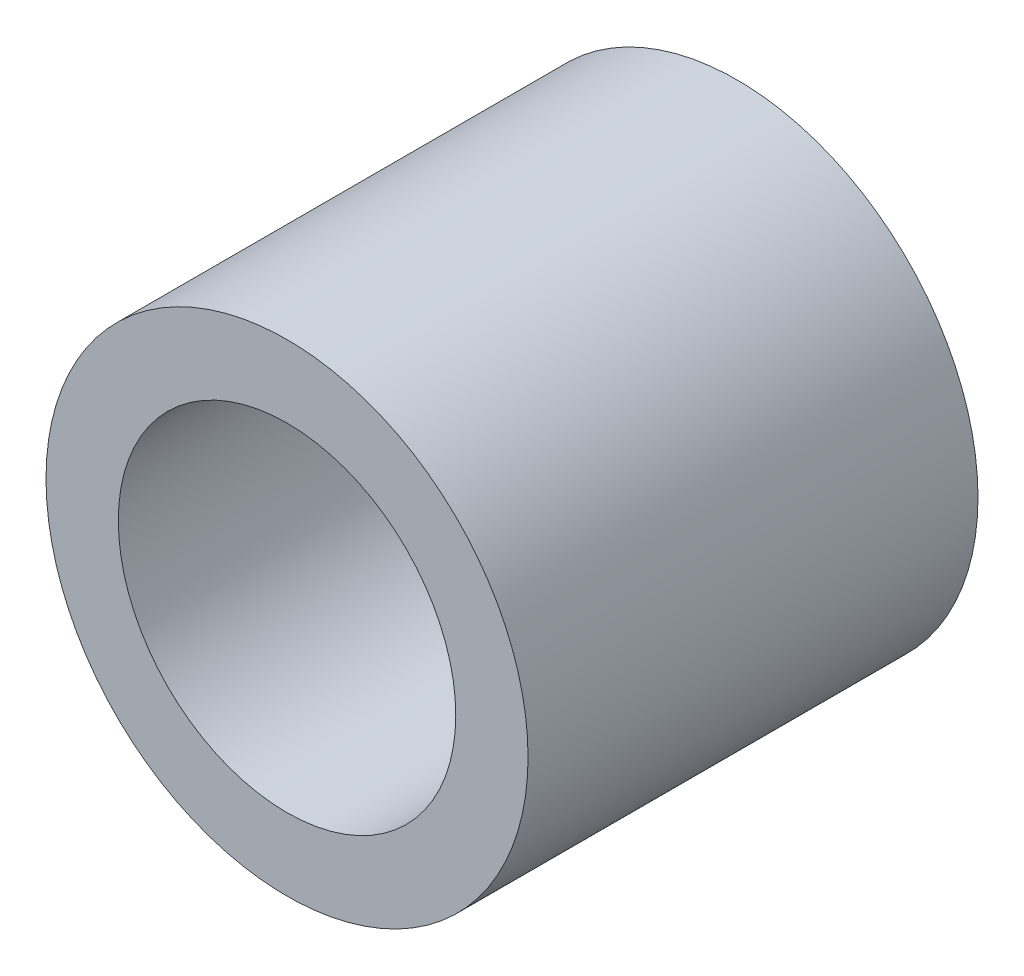
from build123d import *

# Parameters (mm, degrees)
ESBO_O1_R       = 7.5
ESBO_O1_R_2     = 5.25
EXTRUS_O1_DEPTH = 7


with BuildPart() as part:
    # Esboço1 → Extrusão1 (new, symmetric)
    with BuildSketch(Plane.XY):
        Circle(ESBO_O1_R)
        Circle(ESBO_O1_R_2, mode=Mode.SUBTRACT)
    extrude(amount=EXTRUS_O1_DEPTH, both=True)


solid = part.part
